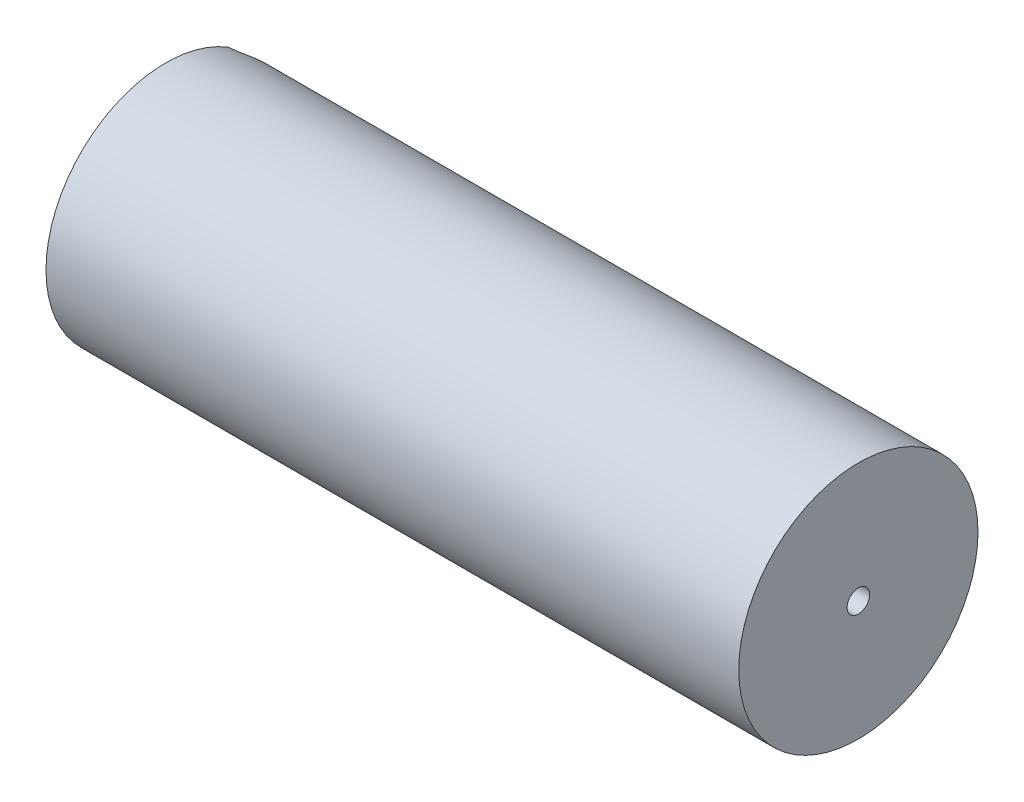
from build123d import *

# Parameters (mm, degrees)
SKETCH_1_W          = 153.4736
SKETCH_1_H          = 24
SKETCH_2_R          = 3.5
CUT_EXTRUDE_1_DEPTH = 230.2104


with BuildPart() as part:
    # 草图1 → 旋转1 (revolve)
    with BuildSketch(Plane.XY, mode=Mode.PRIVATE) as revolve_1_sk:
        with Locations((76.7368, 14.5)):
            Rectangle(SKETCH_1_W, SKETCH_1_H)
    revolve(revolve_1_sk.sketch.rotate(Axis((0, 0, 0), (1, 0, 0)), 90), axis=Axis((0, 0, 0), (1, 0, 0)))

    # 草图2 → 切除-拉伸1 (cut)
    with BuildSketch(Plane.XY):
        with Locations((0, 19)):
            Circle(SKETCH_2_R)
    extrude(amount=-CUT_EXTRUDE_1_DEPTH, mode=Mode.SUBTRACT)


solid = part.part
